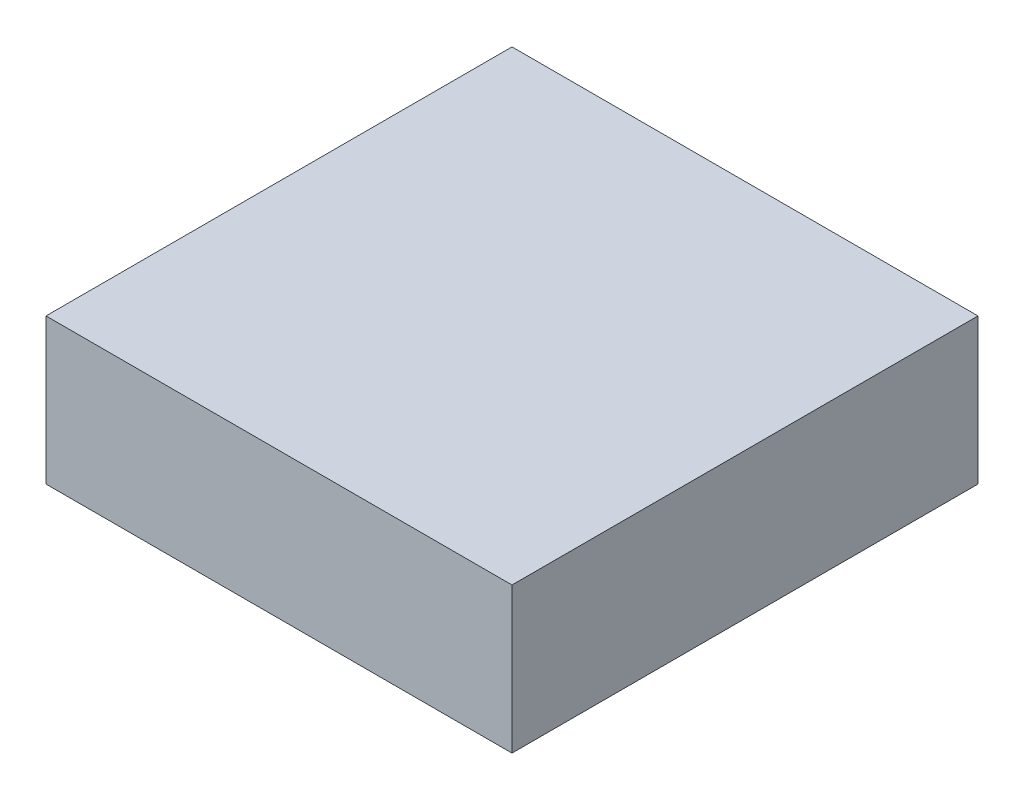
from build123d import *

# Parameters (mm, degrees)
SKETCH1_W           = 1.6
SKETCH1_H           = 1.6
BOSS_EXTRUDE1_DEPTH = 0.5


with BuildPart() as part:
    # Sketch1 → Boss-Extrude1 (new body)
    with BuildSketch(Plane(origin=(0, 0, 0), x_dir=(1, 0, 0), z_dir=(0, 1, 0))):
        Rectangle(SKETCH1_W, SKETCH1_H)
    extrude(amount=BOSS_EXTRUDE1_DEPTH)


solid = part.part
